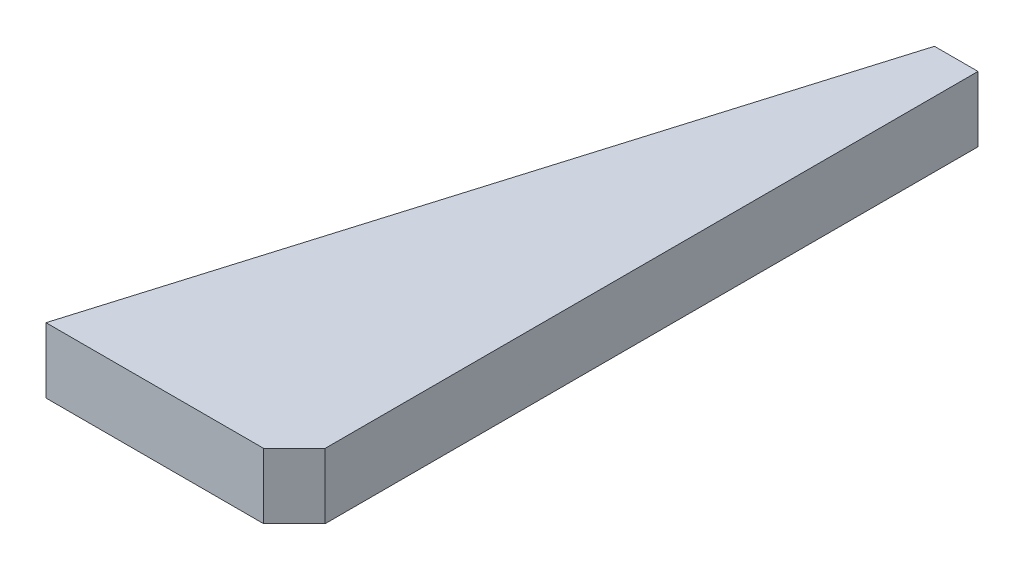
from build123d import *

# Parameters (mm, degrees)
BOSS_EXTRUDE1_DEPTH = 15


with BuildPart() as part:
    # Sketch1 → Boss-Extrude1 (new body)
    with BuildSketch(Plane(origin=(0, 0, 0), x_dir=(1, 0, 0), z_dir=(0, 1, 0))):
        Polygon((0, 0), (0, -150), (-7.071067812, -157.071067812), (-57.071067812, -157.071067812), (-10, 0), align=None)
    extrude(amount=BOSS_EXTRUDE1_DEPTH)


solid = part.part
